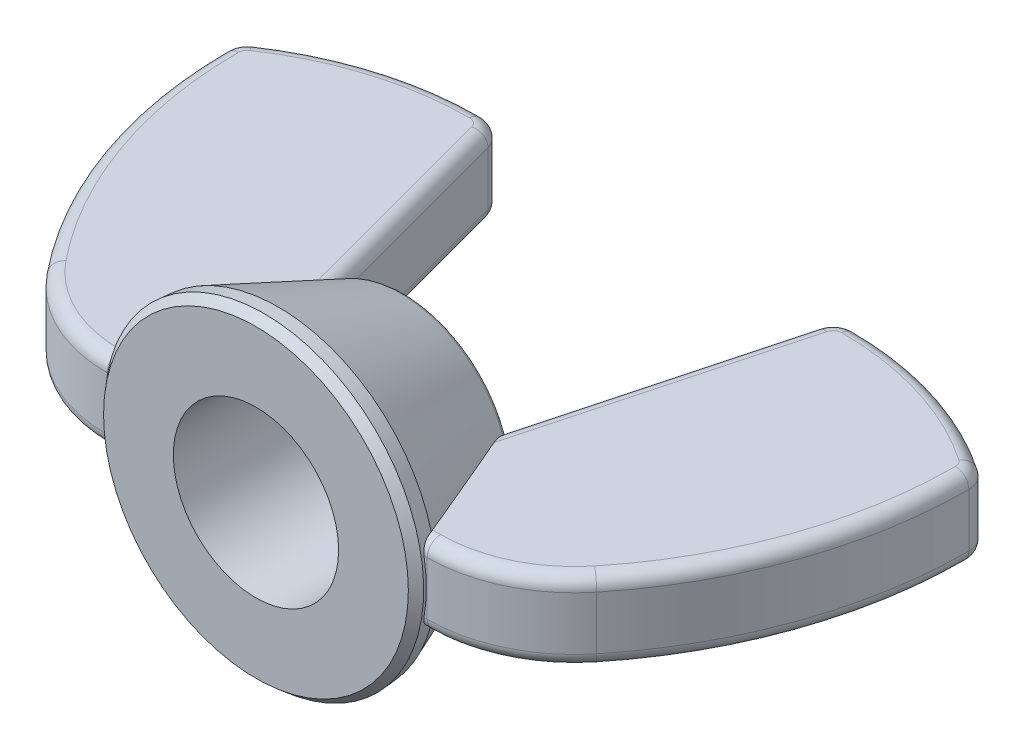
from build123d import *

# Parameters (mm, degrees)
EXTRUDE2_DEPTH     = 1.537890625
SKETCH3_R          = 6.1515625
EXTRUDE1_DEPTH     = 0.85725
EXTRUDE1_DRAFT     = -5
SKETCH15_R         = 6.076562843
EXTRUDE3_DEPTH     = 4.85775
EXTRUDE3_TAPER     = 21.960198558
FILLET3_R          = 0.254
SKETCH4_R          = 3.175
CUT_EXTRUDE1_DEPTH = 23.225885864
CHAMFER1_SIZE      = 0.32146875
CHAMFER1_SIZE2     = 0.296735699
FILLET4_R          = 0.512630208


with BuildPart() as part:
    # Sketch13 → Extrude2 (new, symmetric)
    with BuildSketch(Plane(origin=(0, 0, 0), x_dir=(1, 0, 0), z_dir=(0, 1, 0))):
        with BuildLine():
            Line((3.773545526, 0.428625), (6.1515625, 0.428625))
            ThreePointArc((6.1515625, 0.428625), (8.590910612, 0.981496101), (10.553521716, 2.53205836))
            ThreePointArc((10.553521716, 2.53205836), (13.326559198, 7.495965423), (14.2875, 13.10013378))
            ThreePointArc((14.2875, 13.10013378), (14.187492334, 13.501242622), (13.91088161, 13.808449953))
            ThreePointArc((13.91088161, 13.808449953), (10.685615281, 15.346823078), (7.151500977, 15.875))
            ThreePointArc((7.151500977, 15.875), (6.631385147, 15.698444466), (6.326229714, 15.241747088))
            Line((6.326229714, 15.241747088), (3.773545526, 5.715))
            Line((3.773545526, 5.715), (3.773545526, 0.428625))
        make_face()
    extrude(amount=EXTRUDE2_DEPTH, both=True)

    # Fillet4
    fillet4_edges = [part.edges().sort_by_distance(p)[0] for p in [
        (8.590910612, 1.537890625, -0.981496101),
        (4.962554013, -1.537890625, -0.428625),
        (13.326559198, 1.537890625, -7.495965423),
        (14.187492334, 1.537890625, -13.501242622),
        (10.685615281, 1.537890625, -15.346823078),
        (6.631385147, 1.537890625, -15.698444466),
        (5.04988762, 1.537890625, -10.478373544),
        (4.962554013, 1.537890625, -0.428625),
        (5.04988762, -1.537890625, -10.478373544),
        (6.631385147, -1.537890625, -15.698444466),
        (10.685615281, -1.537890625, -15.346823078),
        (14.187492334, -1.537890625, -13.501242622),
        (13.326559198, -1.537890625, -7.495965423),
        (8.590910612, -1.537890625, -0.981496101),
    ]]
    fillet(fillet4_edges, radius=FILLET4_R)


with BuildPart() as body_2:
    # Sketch3 → Extrude1 (with draft: the straight prism first)
    with BuildSketch(Plane.XY):
        Circle(SKETCH3_R)
    extrude(amount=-EXTRUDE1_DEPTH)
    # Extrude1: the draft: its side faces are tilted about the plane it starts from
    extrude1_sides = [body_2.faces().sort_by_distance(p)[0] for p in [
        (-6.1515625, 0, -0.428625),
    ]]
    draft(extrude1_sides, Plane.XY, EXTRUDE1_DRAFT)

    # Sketch15 → Extrude3 (add)
    with BuildSketch(Plane(origin=(0, 0, -0.85725), x_dir=(-1, 0, 0), z_dir=(0, 0, -1))):
        Circle(SKETCH15_R)
    extrude(amount=EXTRUDE3_DEPTH, taper=EXTRUDE3_TAPER)

    # Fillet3
    fillet3_edges = [body_2.edges().sort_by_distance(p)[0] for p in [
        (4.117828705, 0, -5.715),
    ]]
    fillet(fillet3_edges, radius=FILLET3_R)

    # Sketch4 → Cut-Extrude1 (cut, through all)
    with BuildSketch(Plane.XY):
        Circle(SKETCH4_R)
    extrude(amount=-CUT_EXTRUDE1_DEPTH, mode=Mode.SUBTRACT)

    # Chamfer1
    chamfer1_edges = [body_2.edges().sort_by_distance(p)[0] for p in [
        (-6.1515625, 0, 0),
    ]]
    chamfer1_side = [body_2.faces().sort_by_distance(p)[0] for p in [
        (-6.114062672, 0, -0.428625),
    ]]
    chamfer(chamfer1_edges, length=CHAMFER1_SIZE, length2=CHAMFER1_SIZE2, reference=chamfer1_side[0])


with BuildPart() as body_3:
    # Mirror6: mirrored copy
    add(part.part.mirror(Plane(origin=(0, 0, 0), x_dir=(0, 0, 1), z_dir=(1, 0, 0))))

    # Combine2: union part, body 2
    add(part.part)
    add(body_2.part)


solid = body_3.part
